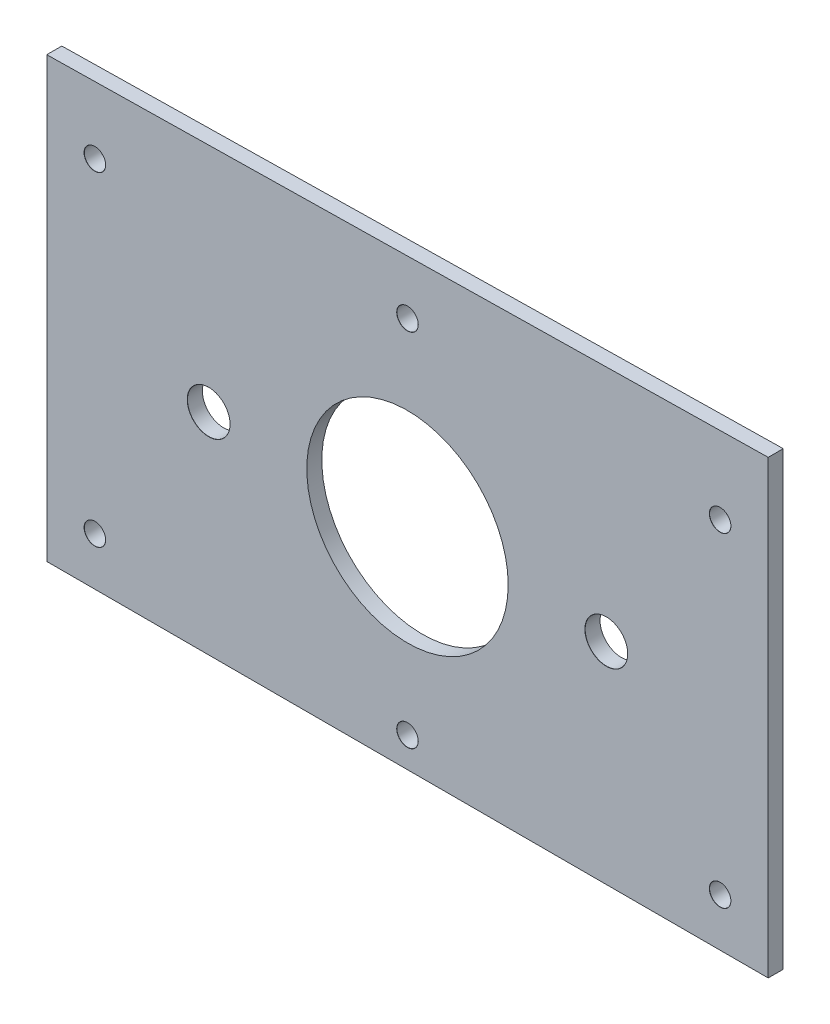
from build123d import *

# Parameters (mm, degrees)
BOSS_EXTRUDE1_DEPTH            = 3.175
M4_CLEARANCE_HOLE1_D           = 4.5
M4_CLEARANCE_HOLE1_CSINK_D     = 4.55
M4_CLEARANCE_HOLE1_CSINK_ANGLE = 90
M8_CLEARANCE_HOLE1_AT_2_COUNT  = 2
M8_CLEARANCE_HOLE1_AT_2_PITCH  = 84
SKETCH9_R                      = 21.275
CENTER_HOLE_DEPTH              = 92.636022529


with BuildPart() as part:
    # Sketch1 → Boss-Extrude1 (new body)
    with BuildSketch(Plane.XY):
        Polygon((-76.2, 48.26), (-76.2, 44.45), (-76.2, -44.45), (76.2, -44.45), (76.2, 44.45), (76.2, 50.8), align=None)
    extrude(amount=BOSS_EXTRUDE1_DEPTH)

    # M4 Clearance Hole1 (through all)
    with Locations(Plane.XY.offset(3.175)):
        with Locations((0, 38.1), (-66.04, 34.29), (-66.04, -34.29), (0, -38.1), (66.04, -34.29), (66.04, 34.29)):
            CounterSinkHole(M4_CLEARANCE_HOLE1_D / 2, M4_CLEARANCE_HOLE1_CSINK_D / 2, counter_sink_angle=M4_CLEARANCE_HOLE1_CSINK_ANGLE)

    # Sketch11 → M8 Clearance Hole1 (revolve, cut)
    with BuildSketch(Plane(origin=(-42, 0, 3.175), x_dir=(0, -1, 0), z_dir=(1, 0, 0))):
        Polygon((0, 0), (0, 3.175), (4.5, 3.175), (4.5, 0.025), (4.525, 0), align=None)
    m8_clearance_hole1 = revolve(axis=Axis((-42, 0, 9.525), (0, 0, -1)), mode=Mode.SUBTRACT)

    # M8 Clearance Hole1 at 2: M8 Clearance Hole1 ×2
    with Locations(*[(i * M8_CLEARANCE_HOLE1_AT_2_PITCH, 0, 0) for i in range(1, M8_CLEARANCE_HOLE1_AT_2_COUNT)]):
        add(m8_clearance_hole1, mode=Mode.SUBTRACT)

    # Sketch9 → Center Hole (cut, through all)
    with BuildSketch(Plane.XY.offset(3.175)):
        Circle(SKETCH9_R)
    extrude(amount=-CENTER_HOLE_DEPTH, mode=Mode.SUBTRACT)


solid = part.part
